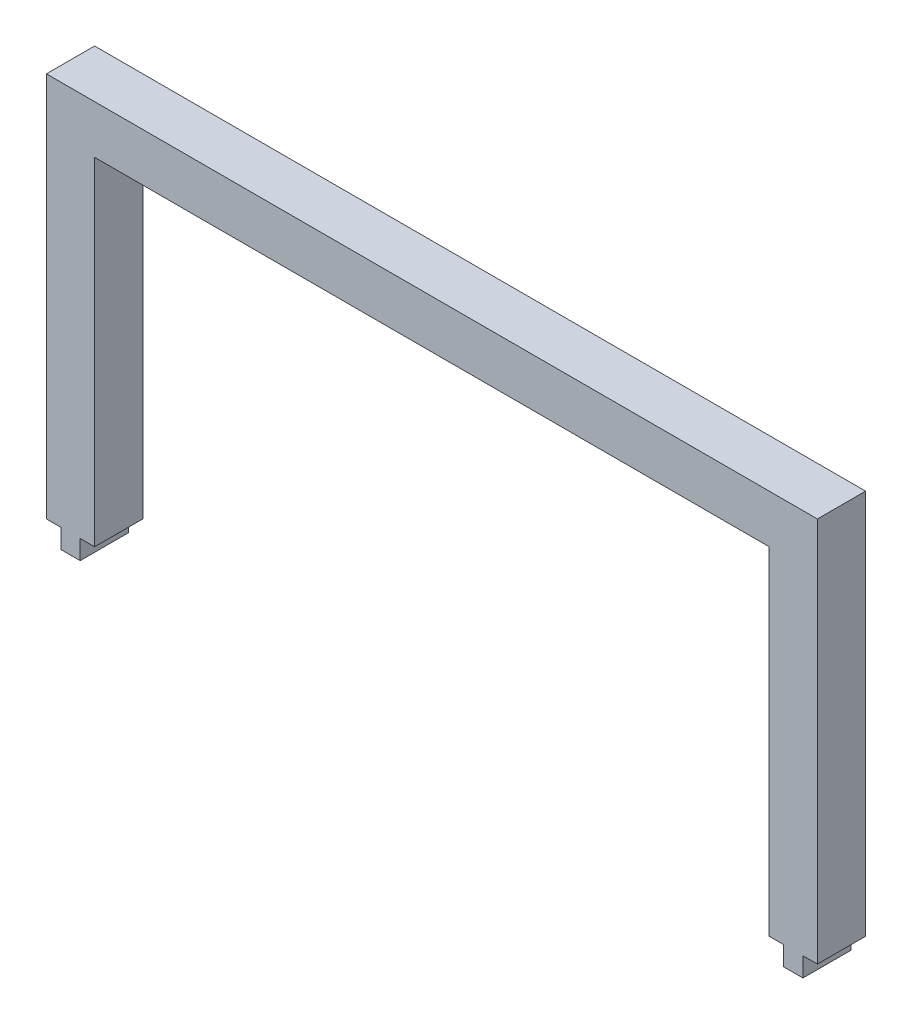
from build123d import *

# Parameters (mm, degrees)
SKETCH1_W           = 20
SKETCH1_H           = 20
BOSS_EXTRUDE1_DEPTH = 50


with BuildPart() as part:
    # Sketch1 → Boss-Extrude1 (new body)
    with BuildSketch(Plane.XY):
        Polygon((297.133757962, 247.133757962), (-502.866242038, 247.133757962), (-502.866242038, -152.866242038), (-487.866242038, -152.866242038), (-467.866242038, -152.866242038), (-452.866242038, -152.866242038), (-452.866242038, 197.133757962), (247.133757962, 197.133757962), (247.133757962, -152.866242038), (262.133757962, -152.866242038), (282.133757962, -152.866242038), (297.133757962, -152.866242038), align=None)
        with Locations((-477.866242038, -162.866242038)):
            Rectangle(SKETCH1_W, SKETCH1_H)
        with Locations((272.133757962, -162.866242038)):
            Rectangle(SKETCH1_W, SKETCH1_H)
    extrude(amount=BOSS_EXTRUDE1_DEPTH)


solid = part.part
